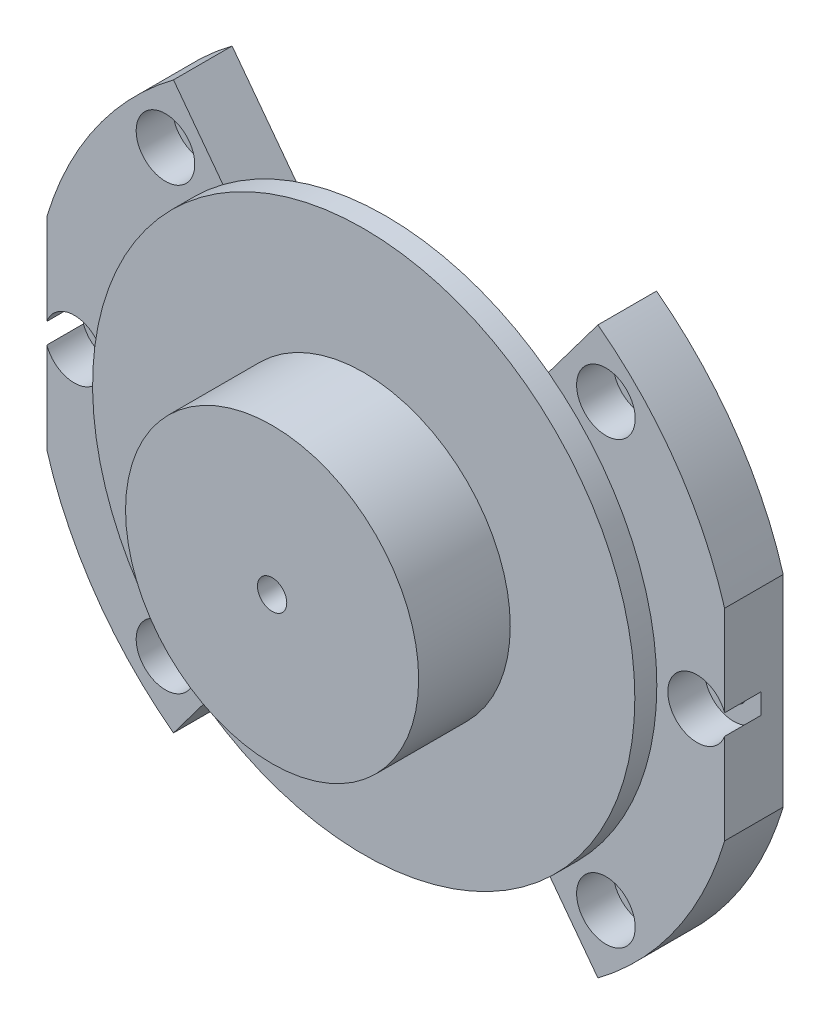
from build123d import *

# Parameters (mm, degrees)
SKETCH1_R           = 48.25
BOSS_EXTRUDE1_DEPTH = 8
SKETCH2_W           = 17.162038191
SKETCH2_H           = 56.822210482
SKETCH2_W_2         = 16.152506533
SKETCH2_H_2         = 65.186901365
CUT_EXTRUDE1_DEPTH  = 8
SKETCH3_R           = 30
CUT_EXTRUDE2_DEPTH  = 8
SKETCH4_R           = 1.75
CUT_EXTRUDE3_DEPTH  = 10
CIRPATTERN1_COUNT   = 8
CUT_EXTRUDE4_DEPTH  = 10
CIRPATTERN2_COUNT   = 2
SKETCH9_R           = 4
CUT_EXTRUDE5_DEPTH  = 5
CIRPATTERN3_COUNT   = 8
SKETCH10_R          = 4
CUT_EXTRUDE6_DEPTH  = 5
SKETCH11_R          = 37
BOSS_EXTRUDE2_DEPTH = 3
SKETCH12_R          = 20
BOSS_EXTRUDE3_DEPTH = 12.5
SKETCH13_R          = 2
CUT_EXTRUDE8_DEPTH  = 38
CUT_EXTRUDE9_DEPTH  = 4


with BuildPart() as part:
    # Sketch1 → Boss-Extrude1 (new body)
    with BuildSketch(Plane.XY):
        Circle(SKETCH1_R)
    extrude(amount=-BOSS_EXTRUDE1_DEPTH)

    # Sketch2 → Cut-Extrude1 (cut)
    with BuildSketch(Plane.XY):
        with Locations((-54.831019095, 0)):
            Rectangle(SKETCH2_W, SKETCH2_H)
        with Locations((54.326253267, -4.182345442)):
            Rectangle(SKETCH2_W_2, SKETCH2_H_2)
    extrude(amount=-CUT_EXTRUDE1_DEPTH, mode=Mode.SUBTRACT)

    # Sketch3 → Cut-Extrude2 (cut)
    with BuildSketch(Plane.XY):
        Circle(SKETCH3_R)
    extrude(amount=-CUT_EXTRUDE2_DEPTH, mode=Mode.SUBTRACT)

    # Sketch4 → Cut-Extrude3 (cut)
    with BuildSketch(Plane.XY):
        with Locations((-42.5, 0)):
            Circle(SKETCH4_R)
    cut_extrude3 = extrude(amount=-CUT_EXTRUDE3_DEPTH, mode=Mode.SUBTRACT)

    # CirPattern1: Cut-Extrude3 ×8 about axis
    cirpattern1_axis = Axis((0, 0, 0), (0, 0, 1))
    for i in range(1, CIRPATTERN1_COUNT):
        add(cut_extrude3.rotate(cirpattern1_axis, i * 360 / CIRPATTERN1_COUNT), mode=Mode.SUBTRACT)

    # Sketch8 → Cut-Extrude4 (cut)
    with BuildSketch(Plane.XY):
        with BuildLine():
            Line((-28.959547499, 38.59283753), (0, 0))
            Line((0, 0), (28.959547499, 38.59283753))
            ThreePointArc((28.959547499, 38.59283753), (0, 48.25), (-28.959547499, 38.59283753))
        make_face()
    cut_extrude4 = extrude(amount=-CUT_EXTRUDE4_DEPTH, mode=Mode.SUBTRACT)

    # CirPattern2: Cut-Extrude4 ×2 about axis
    cirpattern2_axis = Axis((0, 0, 0), (0, 0, 1))
    for i in range(1, CIRPATTERN2_COUNT):
        add(cut_extrude4.rotate(cirpattern2_axis, i * 360 / CIRPATTERN2_COUNT), mode=Mode.SUBTRACT)

    # Sketch9 → Cut-Extrude5 (cut)
    with BuildSketch(Plane.XY):
        with Locations((-42.5, 0)):
            Circle(SKETCH9_R)
    cut_extrude5 = extrude(amount=-CUT_EXTRUDE5_DEPTH, mode=Mode.SUBTRACT)

    # CirPattern3: Cut-Extrude5 ×8 about axis, 3 skipped
    cirpattern3_axis = Axis((0, 0, 0), (0, 0, 1))
    add([cut_extrude5.rotate(cirpattern3_axis, i * 360 / CIRPATTERN3_COUNT) for i in range(1, CIRPATTERN3_COUNT) if i not in (3, 4, 5)], mode=Mode.SUBTRACT)

    # Sketch10 → Cut-Extrude6 (cut)
    with BuildSketch(Plane.XY):
        with Locations((42.5, 0)):
            Circle(SKETCH10_R)
        with Locations((30.0520382, 30.0520382)):
            Circle(SKETCH10_R)
        with Locations((30.0520382, -30.0520382)):
            Circle(SKETCH10_R)
    extrude(amount=-CUT_EXTRUDE6_DEPTH, mode=Mode.SUBTRACT)

    # Sketch11 → Boss-Extrude2 (add)
    with BuildSketch(Plane.XY):
        with Locations(Location((0, 0, 0), (0, 0, 126.884070759))):
            Circle(SKETCH11_R)
    extrude(amount=BOSS_EXTRUDE2_DEPTH)

    # Sketch12 → Boss-Extrude3 (add)
    with BuildSketch(Plane.XY.offset(3)):
        Circle(SKETCH12_R)
    extrude(amount=BOSS_EXTRUDE3_DEPTH)

    # Sketch13 → Cut-Extrude8 (cut)
    with BuildSketch(Plane.XY.offset(15.5)):
        Circle(SKETCH13_R)
    extrude(amount=-CUT_EXTRUDE8_DEPTH, mode=Mode.SUBTRACT)

    # Sketch14 → Cut-Extrude9 (cut)
    with BuildSketch(Plane(origin=(0, 0, 0), x_dir=(-1, 0, 0), z_dir=(0, 0, -1))):
        Polygon((-2.020725942, -3.5), (2.020725942, -3.5), (4.041451884, 0), (2.020725942, 3.5), (-2.020725942, 3.5), (-4.041451884, 0), align=None)
    extrude(amount=-CUT_EXTRUDE9_DEPTH, mode=Mode.SUBTRACT)


solid = part.part
